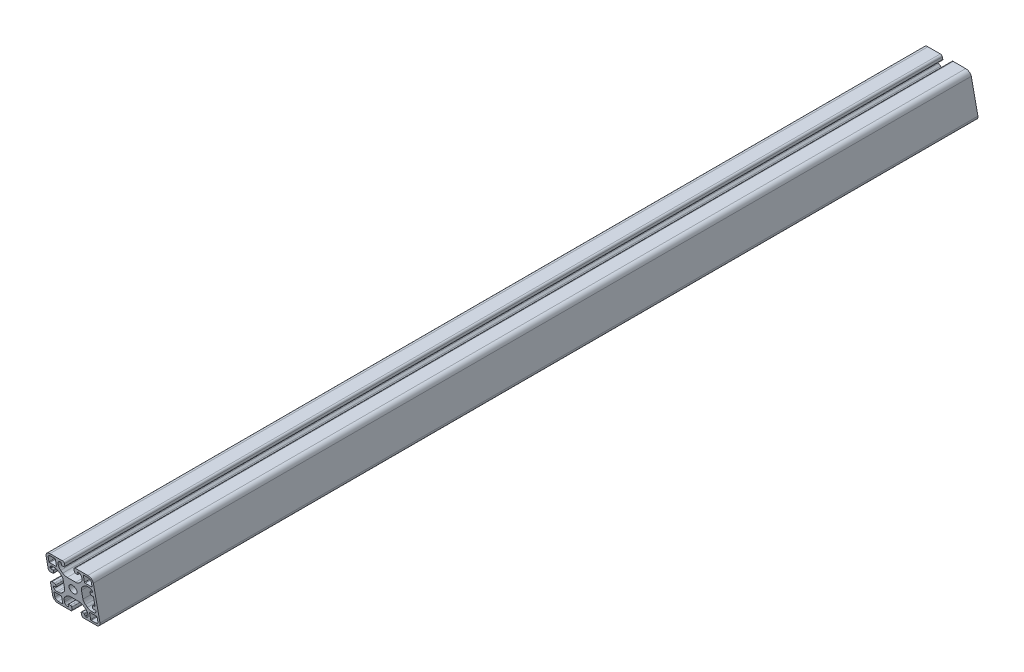
from build123d import *

# Parameters (mm, degrees)
SCHIZZO1_R                   = 3.4
ESTRUSIONE_ESTRUSIONE1_DEPTH = 750
TAGLIO_ESTRUSIONE1_DEPTH     = 413.431812546


with BuildPart() as part:
    # Schizzo1 → Estrusione-Estrusione1 (new body)
    with BuildSketch(Plane(origin=(0, 0, -340), x_dir=(-1, 0, 0), z_dir=(0, 0, -1))):
        with BuildLine():
            Line((6.5, -15.5), (5, -15.5))
            ThreePointArc((5, -15.5), (4.292893219, -15.792893219), (4, -16.5))
            Line((4, -16.5), (4, -18.5))
            ThreePointArc((4, -18.5), (4.439339828, -19.560660172), (5.5, -20))
            Line((5.5, -20), (16, -20))
            ThreePointArc((16, -20), (18.828427125, -18.828427125), (20, -16))
            Line((20, -16), (20, -5.5))
            ThreePointArc((20, -5.5), (19.560660172, -4.439339828), (18.5, -4))
            Line((18.5, -4), (16.5, -4))
            ThreePointArc((16.5, -4), (15.792893219, -4.292893219), (15.5, -5))
            Line((15.5, -5), (15.5, -6.5))
            ThreePointArc((15.5, -6.5), (15.646446609, -6.853553391), (16, -7))
            Line((16, -7), (17.55, -7))
            ThreePointArc((17.55, -7), (17.868198052, -7.131801948), (18, -7.45))
            Line((18, -7.45), (18, -7.5))
            ThreePointArc((18, -7.5), (17.267766953, -9.267766953), (15.5, -10))
            Line((15.5, -10), (14.192388155, -10))
            ThreePointArc((14.192388155, -10), (12.278970994, -9.619397663), (10.656854249, -8.535533906))
            Line((10.656854249, -8.535533906), (9.214466094, -7.09314575))
            ThreePointArc((9.214466094, -7.09314575), (8.130602337, -5.471029006), (7.75, -3.557611845))
            Line((7.75, -3.557611845), (7.75, 3.557611845))
            ThreePointArc((7.75, 3.557611845), (8.130602337, 5.471029006), (9.214466094, 7.09314575))
            Line((9.214466094, 7.09314575), (10.656854249, 8.535533906))
            ThreePointArc((10.656854249, 8.535533906), (12.278970994, 9.619397663), (14.192388155, 10))
            Line((14.192388155, 10), (15.5, 10))
            ThreePointArc((15.5, 10), (17.267766953, 9.267766953), (18, 7.5))
            Line((18, 7.5), (18, 7.45))
            ThreePointArc((18, 7.45), (17.868198052, 7.131801948), (17.55, 7))
            Line((17.55, 7), (16, 7))
            ThreePointArc((16, 7), (15.646446609, 6.853553391), (15.5, 6.5))
            Line((15.5, 6.5), (15.5, 5))
            ThreePointArc((15.5, 5), (15.792893219, 4.292893219), (16.5, 4))
            Line((16.5, 4), (18.5, 4))
            ThreePointArc((18.5, 4), (19.560660172, 4.439339828), (20, 5.5))
            Line((20, 5.5), (20, 16))
            ThreePointArc((20, 16), (18.828427125, 18.828427125), (16, 20))
            Line((16, 20), (5.5, 20))
            ThreePointArc((5.5, 20), (4.439339828, 19.560660172), (4, 18.5))
            Line((4, 18.5), (4, 16.5))
            ThreePointArc((4, 16.5), (4.292893219, 15.792893219), (5, 15.5))
            Line((5, 15.5), (6.5, 15.5))
            ThreePointArc((6.5, 15.5), (6.853553391, 15.646446609), (7, 16))
            Line((7, 16), (7, 17.55))
            ThreePointArc((7, 17.55), (7.131801948, 17.868198052), (7.45, 18))
            Line((7.45, 18), (7.5, 18))
            ThreePointArc((7.5, 18), (9.267766953, 17.267766953), (10, 15.5))
            Line((10, 15.5), (10, 14.192388155))
            ThreePointArc((10, 14.192388155), (9.619397663, 12.278970994), (8.535533906, 10.656854249))
            Line((8.535533906, 10.656854249), (7.09314575, 9.214466094))
            ThreePointArc((7.09314575, 9.214466094), (5.471029006, 8.130602337), (3.557611844, 7.75))
            Line((3.557611844, 7.75), (-3.557611845, 7.75))
            ThreePointArc((-3.557611845, 7.75), (-5.471029006, 8.130602337), (-7.09314575, 9.214466094))
            Line((-7.09314575, 9.214466094), (-8.535533906, 10.656854249))
            ThreePointArc((-8.535533906, 10.656854249), (-9.619397663, 12.278970994), (-10, 14.192388155))
            Line((-10, 14.192388155), (-10, 15.5))
            ThreePointArc((-10, 15.5), (-9.267766953, 17.267766953), (-7.5, 18))
            Line((-7.5, 18), (-7.45, 18))
            ThreePointArc((-7.45, 18), (-7.131801948, 17.868198052), (-7, 17.55))
            Line((-7, 17.55), (-7, 16))
            ThreePointArc((-7, 16), (-6.853553391, 15.646446609), (-6.5, 15.5))
            Line((-6.5, 15.5), (-5, 15.5))
            ThreePointArc((-5, 15.5), (-4.292893219, 15.792893219), (-4, 16.5))
            Line((-4, 16.5), (-4, 18.5))
            ThreePointArc((-4, 18.5), (-4.439339828, 19.560660172), (-5.5, 20))
            Line((-5.5, 20), (-16, 20))
            ThreePointArc((-16, 20), (-18.828427125, 18.828427125), (-20, 16))
            Line((-20, 16), (-20, -16))
            ThreePointArc((-20, -16), (-18.828427125, -18.828427125), (-16, -20))
            Line((-16, -20), (-5.5, -20))
            ThreePointArc((-5.5, -20), (-4.439339828, -19.560660172), (-4, -18.5))
            Line((-4, -18.5), (-4, -16.5))
            ThreePointArc((-4, -16.5), (-4.292893219, -15.792893219), (-5, -15.5))
            Line((-5, -15.5), (-6.5, -15.5))
            ThreePointArc((-6.5, -15.5), (-6.853553391, -15.646446609), (-7, -16))
            Line((-7, -16), (-7, -17.55))
            ThreePointArc((-7, -17.55), (-7.131801948, -17.868198052), (-7.45, -18))
            Line((-7.45, -18), (-7.5, -18))
            ThreePointArc((-7.5, -18), (-9.267766953, -17.267766953), (-10, -15.5))
            Line((-10, -15.5), (-10, -14.192388155))
            ThreePointArc((-10, -14.192388155), (-9.619397663, -12.278970994), (-8.535533906, -10.656854249))
            Line((-8.535533906, -10.656854249), (-7.09314575, -9.214466094))
            ThreePointArc((-7.09314575, -9.214466094), (-5.471029006, -8.130602337), (-3.557611845, -7.75))
            Line((-3.557611845, -7.75), (3.557611845, -7.75))
            ThreePointArc((3.557611845, -7.75), (5.471029006, -8.130602337), (7.09314575, -9.214466094))
            Line((7.09314575, -9.214466094), (8.535533906, -10.656854249))
            ThreePointArc((8.535533906, -10.656854249), (9.619397663, -12.278970994), (10, -14.192388155))
            Line((10, -14.192388155), (10, -15.5))
            ThreePointArc((10, -15.5), (9.267766953, -17.267766953), (7.5, -18))
            Line((7.5, -18), (7.45, -18))
            ThreePointArc((7.45, -18), (7.131801948, -17.868198052), (7, -17.55))
            Line((7, -17.55), (7, -16))
            ThreePointArc((7, -16), (6.853553391, -15.646446609), (6.5, -15.5))
        make_face()
        with Locations(Location((0, 0, 0), (0, 0, 180))):
            Circle(SCHIZZO1_R, mode=Mode.SUBTRACT)
        with BuildLine():
            Line((-12.3, -18.2), (-16, -18.2))
            ThreePointArc((-16, -18.2), (-17.555634919, -17.555634919), (-18.2, -16))
            Line((-18.2, -16), (-18.2, -12.3))
            ThreePointArc((-18.2, -12.3), (-18.053553391, -11.946446609), (-17.7, -11.8))
            Line((-17.7, -11.8), (-12.3, -11.8))
            ThreePointArc((-12.3, -11.8), (-11.946446609, -11.946446609), (-11.8, -12.3))
            Line((-11.8, -12.3), (-11.8, -17.7))
            ThreePointArc((-11.8, -17.7), (-11.946446609, -18.053553391), (-12.3, -18.2))
        make_face(mode=Mode.SUBTRACT)
        with BuildLine():
            Line((-11.8, 17.7), (-11.8, 12.3))
            ThreePointArc((-11.8, 12.3), (-11.946446609, 11.946446609), (-12.3, 11.8))
            Line((-12.3, 11.8), (-17.7, 11.8))
            ThreePointArc((-17.7, 11.8), (-18.053553391, 11.946446609), (-18.2, 12.3))
            Line((-18.2, 12.3), (-18.2, 16))
            ThreePointArc((-18.2, 16), (-17.555634919, 17.555634919), (-16, 18.2))
            Line((-16, 18.2), (-12.3, 18.2))
            ThreePointArc((-12.3, 18.2), (-11.946446609, 18.053553391), (-11.8, 17.7))
        make_face(mode=Mode.SUBTRACT)
        with BuildLine():
            Line((18.2, 16), (18.2, 12.3))
            ThreePointArc((18.2, 12.3), (18.053553391, 11.946446609), (17.7, 11.8))
            Line((17.7, 11.8), (12.3, 11.8))
            ThreePointArc((12.3, 11.8), (11.946446609, 11.946446609), (11.8, 12.3))
            Line((11.8, 12.3), (11.8, 17.7))
            ThreePointArc((11.8, 17.7), (11.946446609, 18.053553391), (12.3, 18.2))
            Line((12.3, 18.2), (16, 18.2))
            ThreePointArc((16, 18.2), (17.555634919, 17.555634919), (18.2, 16))
        make_face(mode=Mode.SUBTRACT)
        with BuildLine():
            Line((18.2, -12.3), (18.2, -16))
            ThreePointArc((18.2, -16), (17.555634919, -17.555634919), (16, -18.2))
            Line((16, -18.2), (12.3, -18.2))
            ThreePointArc((12.3, -18.2), (11.946446609, -18.053553391), (11.8, -17.7))
            Line((11.8, -17.7), (11.8, -12.3))
            ThreePointArc((11.8, -12.3), (11.946446609, -11.946446609), (12.3, -11.8))
            Line((12.3, -11.8), (17.7, -11.8))
            ThreePointArc((17.7, -11.8), (18.053553391, -11.946446609), (18.2, -12.3))
        make_face(mode=Mode.SUBTRACT)
        with BuildLine():
            Line((-16, 7), (-17.5, 7))
            ThreePointArc((-17.5, 7), (-17.853553391, 7.146446609), (-18, 7.5))
            ThreePointArc((-18, 7.5), (-17.267766953, 9.267766953), (-15.5, 10))
            Line((-15.5, 10), (-14.192388155, 10))
            ThreePointArc((-14.192388155, 10), (-12.278970994, 9.619397663), (-10.656854249, 8.535533906))
            Line((-10.656854249, 8.535533906), (-9.214466094, 7.093145751))
            ThreePointArc((-9.214466094, 7.093145751), (-8.130602337, 5.471029006), (-7.75, 3.557611845))
            Line((-7.75, 3.557611845), (-7.75, -3.557611845))
            ThreePointArc((-7.75, -3.557611845), (-8.130602337, -5.471029006), (-9.214466094, -7.093145751))
            Line((-9.214466094, -7.093145751), (-10.656854249, -8.535533906))
            ThreePointArc((-10.656854249, -8.535533906), (-12.278970994, -9.619397663), (-14.192388155, -10))
            Line((-14.192388155, -10), (-15.5, -10))
            ThreePointArc((-15.5, -10), (-17.267766953, -9.267766953), (-18, -7.5))
            ThreePointArc((-18, -7.5), (-17.853553391, -7.146446609), (-17.5, -7))
            Line((-17.5, -7), (-16, -7))
            ThreePointArc((-16, -7), (-15.646446609, -6.853553391), (-15.5, -6.5))
            Line((-15.5, -6.5), (-15.5, -5))
            ThreePointArc((-15.5, -5), (-15.792893219, -4.292893219), (-16.5, -4))
            Line((-16.5, -4), (-17.5, -4))
            ThreePointArc((-17.5, -4), (-17.853553391, -3.853553391), (-18, -3.5))
            Line((-18, -3.5), (-18, 3.5))
            ThreePointArc((-18, 3.5), (-17.853553391, 3.853553391), (-17.5, 4))
            Line((-17.5, 4), (-16.5, 4))
            ThreePointArc((-16.5, 4), (-15.792893219, 4.292893219), (-15.5, 5))
            Line((-15.5, 5), (-15.5, 6.5))
            ThreePointArc((-15.5, 6.5), (-15.646446609, 6.853553391), (-16, 7))
        make_face(mode=Mode.SUBTRACT)
    extrude(amount=-ESTRUSIONE_ESTRUSIONE1_DEPTH)

    # Schizzo9 → Taglio-Estrusione1 (cut, through all)
    with BuildSketch(Plane(origin=(20, 0, 0), x_dir=(0, 0, -1), z_dir=(1, 0, 0))):
        Polygon((340, -20), (340, 20), (332.946920772, 20), align=None)
        Polygon((-410, -20), (-402.952160621, -20), (-410, 20), align=None)
    extrude(amount=-TAGLIO_ESTRUSIONE1_DEPTH, mode=Mode.SUBTRACT)


solid = part.part
